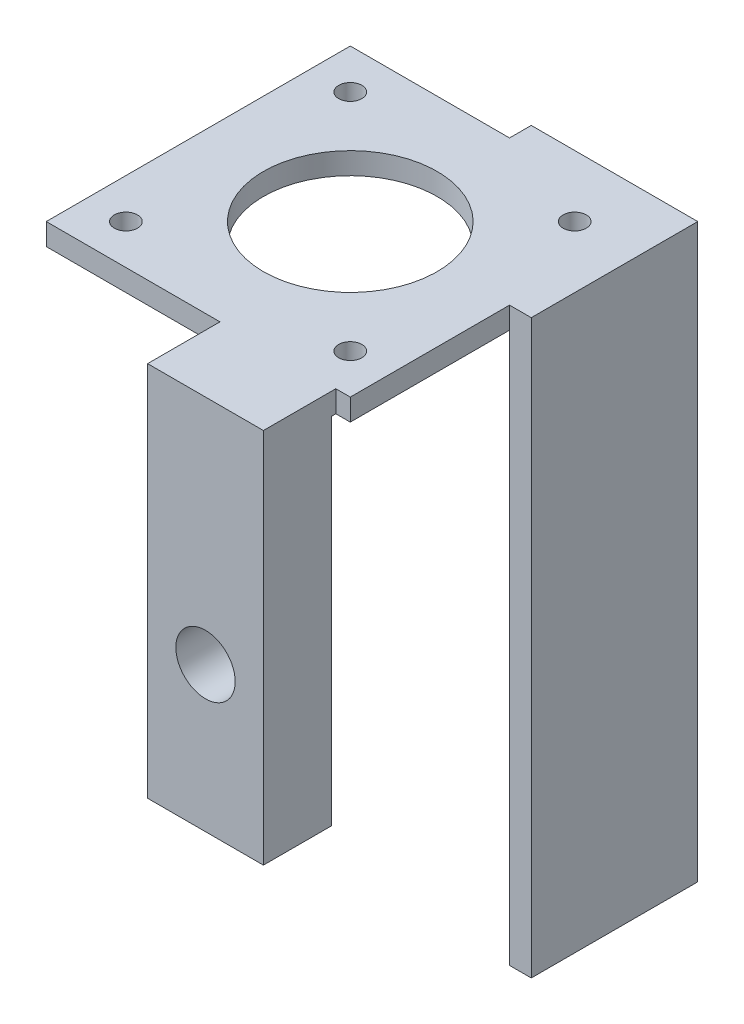
from build123d import *

# Parameters (mm, degrees)
SKETCH_1_W          = 42
SKETCH_1_H          = 42
SKETCH_1_R          = 1.6
SKETCH_1_R_2        = 12
EXTRUDE_1_DEPTH     = 3
SKETCH_2_W          = 16
SKETCH_2_H          = 52
EXTRUDE_2_DEPTH     = 10
SKETCH_3_R          = 4.1
CUT_EXTRUDE_1_DEPTH = 6
EXTRUDE_3_DEPTH     = 79
SKETCH_7_W          = 16
SKETCH_7_H          = 0.6
CUT_EXTRUDE_4_DEPTH = 49
EXTRUDE_START       = 49.4
EXTRUDE_4_DEPTH     = 26.6
SKETCH_10_W         = 7.1
SKETCH_10_H         = 0.1
SKETCH_10_W_2       = 0.1
SKETCH_10_H_2       = 7.1
CUT_EXTRUDE_5_DEPTH = 76


with BuildPart() as part:
    # 草图1 → 凸台-拉伸1 (new body)
    with BuildSketch(Plane(origin=(0, 0, 0), x_dir=(1, 0, 0), z_dir=(0, 1, 0))):
        Rectangle(SKETCH_1_W, SKETCH_1_H)
        with Locations(Location((15.5, 15.5, 0), (0, 0, 270))):
            Circle(SKETCH_1_R, mode=Mode.SUBTRACT)
        with Locations(Location((15.5, -15.5, 0), (0, 0, 270))):
            Circle(SKETCH_1_R, mode=Mode.SUBTRACT)
        with Locations(Location((-15.5, -15.5, 0), (0, 0, 270))):
            Circle(SKETCH_1_R, mode=Mode.SUBTRACT)
        with Locations(Location((-15.5, 15.5, 0), (0, 0, 270))):
            Circle(SKETCH_1_R, mode=Mode.SUBTRACT)
        with Locations(Location((0, 0, 0), (0, 0, 270))):
            Circle(SKETCH_1_R_2, mode=Mode.SUBTRACT)
    extrude(amount=EXTRUDE_1_DEPTH)

    # 草图2 → 凸台-拉伸2 (add)
    with BuildSketch(Plane.XY.offset(21)):
        with Locations((11, -23)):
            Rectangle(SKETCH_2_W, SKETCH_2_H)
    extrude(amount=EXTRUDE_2_DEPTH)

    # 草图3 → 切除-拉伸1 (cut)
    with BuildSketch(Plane.XY.offset(31)):
        with Locations((11, -29)):
            Circle(SKETCH_3_R)
    extrude(amount=-CUT_EXTRUDE_1_DEPTH, mode=Mode.SUBTRACT)

    # 草图4 → 凸台-拉伸3 (add)
    with BuildSketch(Plane(origin=(0, 3, 0), x_dir=(1, 0, 0), z_dir=(0, 1, 0))):
        Polygon((1, 21), (21, 21), (21, 1), (24, 1), (24, 24), (1, 24), align=None)
    extrude(amount=-EXTRUDE_3_DEPTH)

    # 草图7 → 切除-拉伸4 (cut)
    with BuildSketch(Plane.XZ.offset(49)):
        with Locations((11, 21.3)):
            Rectangle(SKETCH_7_W, SKETCH_7_H)
    extrude(amount=-CUT_EXTRUDE_4_DEPTH, mode=Mode.SUBTRACT)

    # 草图9 → 凸台-拉伸4 (add)
    with BuildSketch(Plane.XZ.offset(EXTRUDE_START)):
        Polygon((8.33, -15.1), (13.667157288, -15.1), (16.3, -17.732842712), (16.3, -19.3), (13.9, -19.3), (13.9, -21), (8.1, -21), (8.1, -19.3), (5.7, -19.3), (5.7, -17.73), align=None)
    extrude_4 = extrude(amount=EXTRUDE_4_DEPTH)

    # 镜向1: 凸台-拉伸4 across plane
    add(extrude_4.mirror(Plane(origin=(0, 0, 0), x_dir=(-0.7071067811865475, 0, 0.7071067811865476), z_dir=(-0.7071067811865478, 0, -0.7071067811865474))))

    # 草图10 → 切除-拉伸5 (cut)
    with BuildSketch(Plane.XZ.offset(76)):
        with Locations((4.55, -21.05)):
            Rectangle(SKETCH_10_W, SKETCH_10_H)
        with Locations((17.45, -21.05)):
            Rectangle(SKETCH_10_W, SKETCH_10_H)
        with Locations((21.05, -21.05)):
            Rectangle(SKETCH_10_W_2, SKETCH_10_H)
        with Locations((21.05, -17.45)):
            Rectangle(SKETCH_10_W_2, SKETCH_10_H_2)
    extrude(amount=-CUT_EXTRUDE_5_DEPTH, mode=Mode.SUBTRACT)


solid = part.part
